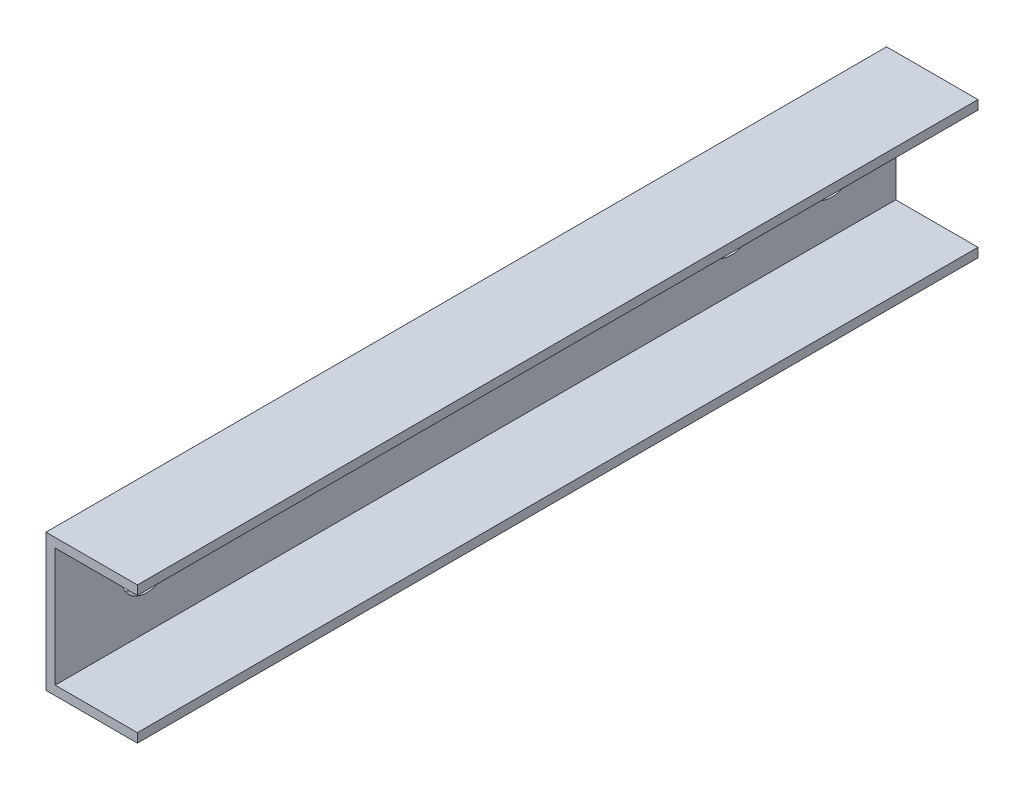
from build123d import *

# Parameters (mm, degrees)
CROQUIS1_W                 = 15
CROQUIS1_H                 = 92
CROQUIS1_W_2               = 13
CROQUIS1_H_2               = 90
EXTRUIR_L_MINA1_DEPTH      = 10
CROQUIS2_W                 = 9
CROQUIS2_H                 = 13
CORTAR_EXTRUIR2_DEPTH      = 94.594871654
CROQUIS5_W                 = 13
CROQUIS5_H                 = 90
SALIENTE_EXTRUIR1_DEPTH    = 1
CORTAR_EXTRUIR3_DEPTH      = 93.509458976
CORTAR_EXTRUIR3_DEPTH_BACK = 93.509458976
CROQUIS6_R                 = 2.75


with BuildPart() as part:
    # Croquis1 → Extruir-Lámina1 (new body)
    with BuildSketch(Plane.YZ):
        with Locations((6.5, 45)):
            Rectangle(CROQUIS1_W, CROQUIS1_H)
        with Locations((6.5, 45)):
            Rectangle(CROQUIS1_W_2, CROQUIS1_H_2, mode=Mode.SUBTRACT)
    extrude(amount=EXTRUIR_L_MINA1_DEPTH)

    # Croquis2 → Cortar-Extruir2 (cut, through all)
    with BuildSketch(Plane(origin=(0, 0, -1), x_dir=(1, 0, 0), z_dir=(0, 0, -1))):
        with Locations((5.5, -6.5)):
            Rectangle(CROQUIS2_W, CROQUIS2_H)
    extrude(amount=-CORTAR_EXTRUIR2_DEPTH, mode=Mode.SUBTRACT)

    # Croquis5 → Saliente-Extruir1 (add)
    with BuildSketch(Plane(origin=(0, 0, 0), x_dir=(0, -1, 0), z_dir=(-1, 0, 0))):
        with Locations((-6.5, 45)):
            Rectangle(CROQUIS5_W, CROQUIS5_H)
    extrude(amount=-SALIENTE_EXTRUIR1_DEPTH)

    # Croquis6 → Cortar-Extruir3 (cut, two sides: drawn at the far end of the back side and taken through both)
    with BuildSketch(Plane.YZ.offset(1).offset(-CORTAR_EXTRUIR3_DEPTH_BACK)):
        with Locations((6.5, 17)):
            Circle(CROQUIS6_R)
        with Locations((6.5, 81)):
            Circle(CROQUIS6_R)
        with Locations((6.5, 6)):
            Circle(CROQUIS6_R)
    extrude(amount=CORTAR_EXTRUIR3_DEPTH + CORTAR_EXTRUIR3_DEPTH_BACK, mode=Mode.SUBTRACT)


solid = part.part
